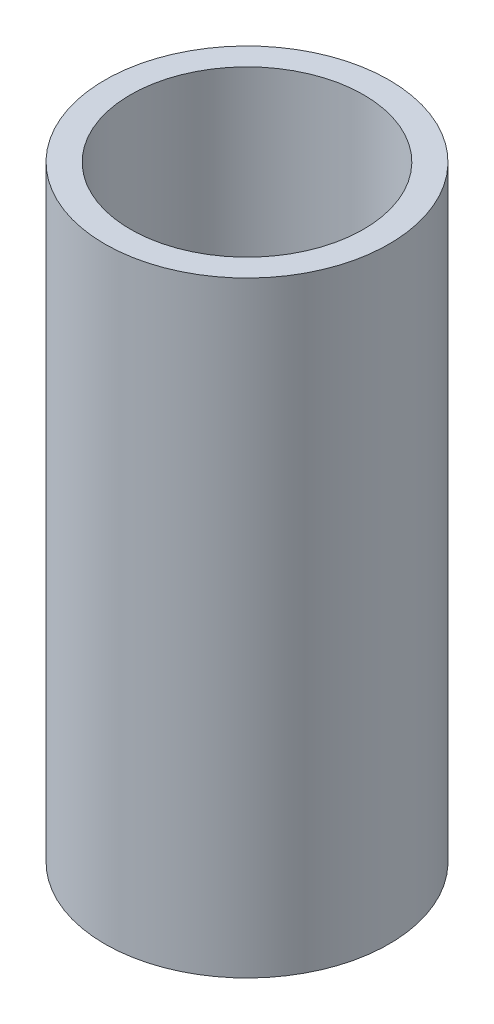
from build123d import *

# Parameters (mm, degrees)
SKETCH1_R           = 3.048
SKETCH1_R_2         = 2.5
BOSS_EXTRUDE1_DEPTH = 6.5


with BuildPart() as part:
    # Sketch1 → Boss-Extrude1 (new, symmetric)
    with BuildSketch(Plane(origin=(0, 0, 0), x_dir=(1, 0, 0), z_dir=(0, 1, 0))):
        with Locations(Location((0, 0, 0), (0, 0, 90))):
            Circle(SKETCH1_R)
        with Locations(Location((0, 0, 0), (0, 0, 90))):
            Circle(SKETCH1_R_2, mode=Mode.SUBTRACT)
    extrude(amount=BOSS_EXTRUDE1_DEPTH, both=True)


solid = part.part
